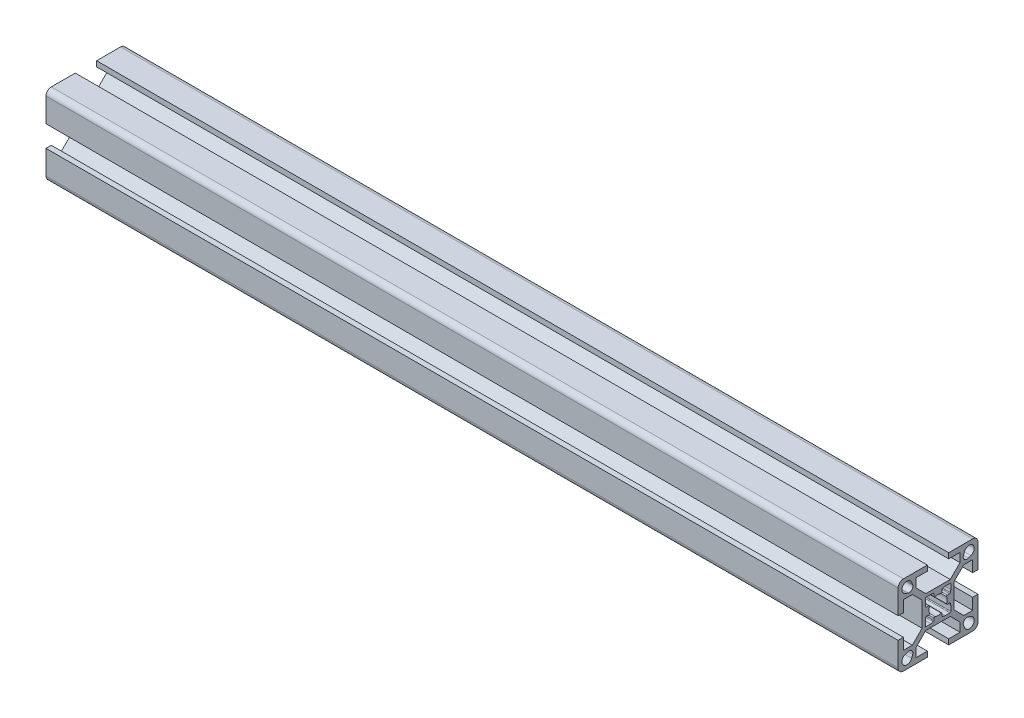
from build123d import *

# Parameters (mm, degrees)
BOSS_EXTRUDE1_DEPTH = 320


with BuildPart() as part:
    # Sketch1 → Boss-Extrude1 (new body)
    with BuildSketch(Plane(origin=(0, 0, 0), x_dir=(0, 0, -1), z_dir=(1, 0, 0))):
        with BuildLine():
            Line((-15, 13), (-15, 4))
            Line((-15, 4), (-13, 4))
            Line((-13, 4), (-13, 8.25))
            Line((-13, 8.25), (-9.664213562, 8.25))
            Line((-9.664213562, 8.25), (-6, 4.585786438))
            Line((-6, 4.585786438), (-6, -4.585786438))
            Line((-6, -4.585786438), (-9.664213562, -8.25))
            Line((-9.664213562, -8.25), (-13, -8.25))
            Line((-13, -8.25), (-13, -4))
            Line((-13, -4), (-15, -4))
            Line((-15, -4), (-15, -13))
            ThreePointArc((-15, -13), (-14.414213562, -14.414213562), (-13, -15))
            Line((-13, -15), (-4, -15))
            Line((-4, -15), (-4, -13))
            Line((-4, -13), (-8.25, -13))
            Line((-8.25, -13), (-8.25, -9.664213562))
            Line((-8.25, -9.664213562), (-4.585786438, -6))
            Line((-4.585786438, -6), (4.585786438, -6))
            Line((4.585786438, -6), (8.25, -9.664213562))
            Line((8.25, -9.664213562), (8.25, -13))
            Line((8.25, -13), (4, -13))
            Line((4, -13), (4, -15))
            Line((4, -15), (13, -15))
            ThreePointArc((13, -15), (14.414213562, -14.414213562), (15, -13))
            Line((15, -13), (15, -4))
            Line((15, -4), (13, -4))
            Line((13, -4), (13, -8.25))
            Line((13, -8.25), (9.664213562, -8.25))
            Line((9.664213562, -8.25), (6, -4.585786438))
            Line((6, -4.585786438), (6, 4.585786438))
            Line((6, 4.585786438), (9.664213562, 8.25))
            Line((9.664213562, 8.25), (13, 8.25))
            Line((13, 8.25), (13, 4))
            Line((13, 4), (15, 4))
            Line((15, 4), (15, 13))
            ThreePointArc((15, 13), (14.414213562, 14.414213562), (13, 15))
            Line((13, 15), (4, 15))
            Line((4, 15), (4, 13))
            Line((4, 13), (8.25, 13))
            Line((8.25, 13), (8.25, 9.664213562))
            Line((8.25, 9.664213562), (4.585786438, 6))
            Line((4.585786438, 6), (-4.585786438, 6))
            Line((-4.585786438, 6), (-8.25, 9.664213562))
            Line((-8.25, 9.664213562), (-8.25, 13))
            Line((-8.25, 13), (-4, 13))
            Line((-4, 13), (-4, 15))
            Line((-4, 15), (-13, 15))
            ThreePointArc((-13, 15), (-14.414213562, 14.414213562), (-15, 13))
        make_face()
        with BuildLine():
            Line((-9.539070071, 11.338915743), (-9.918883282, 12.361530981))
            ThreePointArc((-9.918883282, 12.361530981), (-13.043502884, 13.043502884), (-12.361530981, 9.918883282))
            Line((-12.361530981, 9.918883282), (-11.338915743, 9.539070071))
            ThreePointArc((-11.338915743, 9.539070071), (-9.861522369, 9.861522369), (-9.539070071, 11.338915743))
        make_face(mode=Mode.SUBTRACT)
        with BuildLine():
            Line((9.918883282, 12.361530981), (9.539070071, 11.338915743))
            ThreePointArc((9.539070071, 11.338915743), (9.861522369, 9.861522369), (11.338915743, 9.539070071))
            Line((11.338915743, 9.539070071), (12.361530981, 9.918883282))
            ThreePointArc((12.361530981, 9.918883282), (13.043502884, 13.043502884), (9.918883282, 12.361530981))
        make_face(mode=Mode.SUBTRACT)
        with BuildLine():
            Line((12.361530981, -9.918883282), (11.338915743, -9.539070071))
            ThreePointArc((11.338915743, -9.539070071), (9.861522369, -9.861522369), (9.539070071, -11.338915743))
            Line((9.539070071, -11.338915743), (9.918883282, -12.361530981))
            ThreePointArc((9.918883282, -12.361530981), (13.043502884, -13.043502884), (12.361530981, -9.918883282))
        make_face(mode=Mode.SUBTRACT)
        with BuildLine():
            Line((-11.338915743, -9.539070071), (-12.361530981, -9.918883282))
            ThreePointArc((-12.361530981, -9.918883282), (-13.043502884, -13.043502884), (-9.918883282, -12.361530981))
            Line((-9.918883282, -12.361530981), (-9.539070071, -11.338915743))
            ThreePointArc((-9.539070071, -11.338915743), (-9.861522369, -9.861522369), (-11.338915743, -9.539070071))
        make_face(mode=Mode.SUBTRACT)
        with BuildLine():
            Line((-4.8, -2.644433572), (-4.8, -4.5))
            ThreePointArc((-4.8, -4.5), (-4.712132034, -4.712132034), (-4.5, -4.8))
            Line((-4.5, -4.8), (-2.644433572, -4.8))
            ThreePointArc((-2.644433572, -4.8), (-2.615679847, -4.79861886), (-2.587190874, -4.794488155))
            Line((-2.587190874, -4.794488155), (-1.742757301, -4.630346896))
            ThreePointArc((-1.742757301, -4.630346896), (-1.568512625, -4.526682207), (-1.5, -4.335858741))
            Line((-1.5, -4.335858741), (-1.5, -3.5))
            ThreePointArc((-1.5, -3.5), (-1.374371458, -3.255879959), (-1.102702703, -3.216216216))
            ThreePointArc((-1.102702703, -3.216216216), (0, -3.4), (1.102702703, -3.216216216))
            ThreePointArc((1.102702703, -3.216216216), (1.374371458, -3.255879959), (1.5, -3.5))
            Line((1.5, -3.5), (1.5, -4.335858741))
            ThreePointArc((1.5, -4.335858741), (1.568512625, -4.526682207), (1.742757301, -4.630346896))
            Line((1.742757301, -4.630346896), (2.587190874, -4.794488155))
            ThreePointArc((2.587190874, -4.794488155), (2.615679847, -4.79861886), (2.644433572, -4.8))
            Line((2.644433572, -4.8), (4.5, -4.8))
            ThreePointArc((4.5, -4.8), (4.712132034, -4.712132034), (4.8, -4.5))
            Line((4.8, -4.5), (4.8, -2.644433572))
            ThreePointArc((4.8, -2.644433572), (4.79861886, -2.615679847), (4.794488155, -2.587190874))
            Line((4.794488155, -2.587190874), (4.630346896, -1.742757301))
            ThreePointArc((4.630346896, -1.742757301), (4.526682207, -1.568512625), (4.335858741, -1.5))
            Line((4.335858741, -1.5), (3.5, -1.5))
            ThreePointArc((3.5, -1.5), (3.255879959, -1.374371458), (3.216216216, -1.102702703))
            ThreePointArc((3.216216216, -1.102702703), (3.4, 0), (3.216216216, 1.102702703))
            ThreePointArc((3.216216216, 1.102702703), (3.255879959, 1.374371458), (3.5, 1.5))
            Line((3.5, 1.5), (4.335858741, 1.5))
            ThreePointArc((4.335858741, 1.5), (4.526682207, 1.568512625), (4.630346896, 1.742757301))
            Line((4.630346896, 1.742757301), (4.794488155, 2.587190874))
            ThreePointArc((4.794488155, 2.587190874), (4.79861886, 2.615679847), (4.8, 2.644433572))
            Line((4.8, 2.644433572), (4.8, 4.5))
            ThreePointArc((4.8, 4.5), (4.712132034, 4.712132034), (4.5, 4.8))
            Line((4.5, 4.8), (2.644433572, 4.8))
            ThreePointArc((2.644433572, 4.8), (2.615679847, 4.79861886), (2.587190874, 4.794488155))
            Line((2.587190874, 4.794488155), (1.742757301, 4.630346896))
            ThreePointArc((1.742757301, 4.630346896), (1.568512625, 4.526682207), (1.5, 4.335858741))
            Line((1.5, 4.335858741), (1.5, 3.5))
            ThreePointArc((1.5, 3.5), (1.374371458, 3.255879959), (1.102702703, 3.216216216))
            ThreePointArc((1.102702703, 3.216216216), (0, 3.4), (-1.102702703, 3.216216216))
            ThreePointArc((-1.102702703, 3.216216216), (-1.374371458, 3.255879959), (-1.5, 3.5))
            Line((-1.5, 3.5), (-1.5, 4.335858741))
            ThreePointArc((-1.5, 4.335858741), (-1.568512625, 4.526682207), (-1.742757301, 4.630346896))
            Line((-1.742757301, 4.630346896), (-2.587190874, 4.794488155))
            ThreePointArc((-2.587190874, 4.794488155), (-2.615679847, 4.79861886), (-2.644433572, 4.8))
            Line((-2.644433572, 4.8), (-4.5, 4.8))
            ThreePointArc((-4.5, 4.8), (-4.712132034, 4.712132034), (-4.8, 4.5))
            Line((-4.8, 4.5), (-4.8, 2.644433572))
            ThreePointArc((-4.8, 2.644433572), (-4.79861886, 2.615679847), (-4.794488155, 2.587190874))
            Line((-4.794488155, 2.587190874), (-4.630346896, 1.742757301))
            ThreePointArc((-4.630346896, 1.742757301), (-4.526682207, 1.568512625), (-4.335858741, 1.5))
            Line((-4.335858741, 1.5), (-3.5, 1.5))
            ThreePointArc((-3.5, 1.5), (-3.255879959, 1.374371458), (-3.216216216, 1.102702703))
            ThreePointArc((-3.216216216, 1.102702703), (-3.4, 0), (-3.216216216, -1.102702703))
            ThreePointArc((-3.216216216, -1.102702703), (-3.255879959, -1.374371458), (-3.5, -1.5))
            Line((-3.5, -1.5), (-4.335858741, -1.5))
            ThreePointArc((-4.335858741, -1.5), (-4.526682207, -1.568512625), (-4.630346896, -1.742757301))
            Line((-4.630346896, -1.742757301), (-4.794488155, -2.587190874))
            ThreePointArc((-4.794488155, -2.587190874), (-4.79861886, -2.615679847), (-4.8, -2.644433572))
        make_face(mode=Mode.SUBTRACT)
    extrude(amount=BOSS_EXTRUDE1_DEPTH)


solid = part.part
